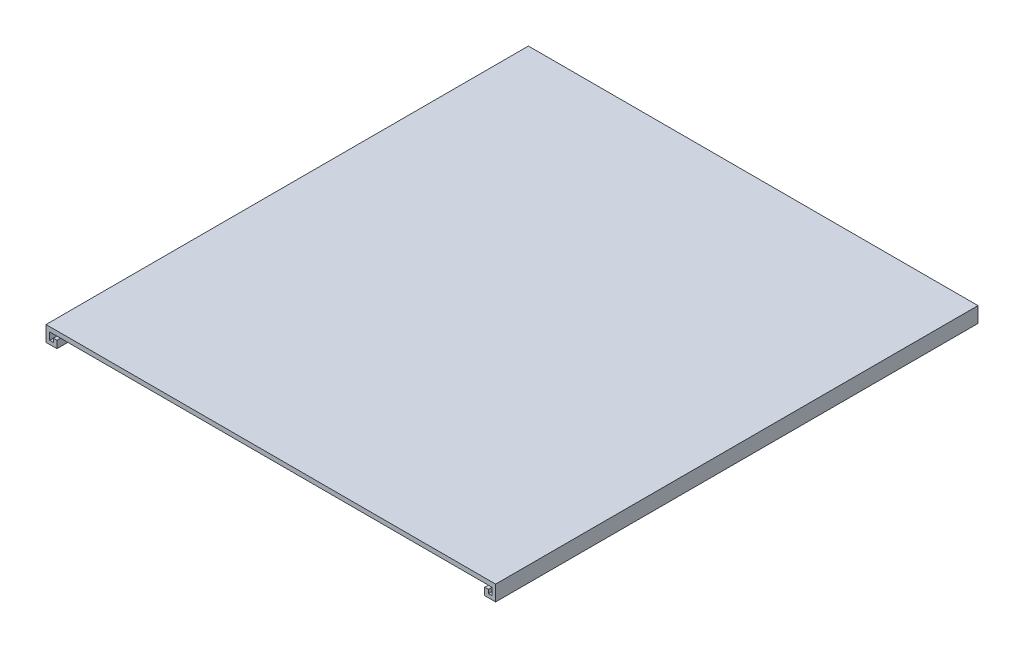
from build123d import *

# Parameters (mm, degrees)
SKETCH2_W                = 243
SKETCH2_H                = 265
BOSS_EXTRUDE1_DEPTH      = 2.5
BOSS_EXTRUDE2_DEPTH      = 4
BOSS_EXTRUDE2_DEPTH_BACK = 2.5
SKETCH3_W                = 2
SKETCH3_H                = 265
BOSS_EXTRUDE3_DEPTH      = 4
BOSS_EXTRUDE3_DEPTH_BACK = 2.5
SKETCH4_W                = 2
SKETCH4_H                = 265
BOSS_EXTRUDE4_DEPTH      = 2
BOSS_EXTRUDE4_DEPTH_BACK = 2
SKETCH5_W                = 265
SKETCH5_H                = 2
BOSS_EXTRUDE5_DEPTH      = 2
BOSS_EXTRUDE5_DEPTH_BACK = 2
SKETCH6_W                = 265
SKETCH6_H                = 2
SKETCH7_W                = 2
SKETCH7_H                = 265
BOSS_EXTRUDE7_DEPTH      = 4
SKETCH8_W                = 2
SKETCH8_H                = 265
BOSS_EXTRUDE8_DEPTH      = 4


with BuildPart() as part:
    # Sketch2 → Boss-Extrude1 (new body)
    with BuildSketch(Plane(origin=(0, 0, 0), x_dir=(1, 0, 0), z_dir=(0, 1, 0))):
        Rectangle(SKETCH2_W, SKETCH2_H)
    extrude(amount=BOSS_EXTRUDE1_DEPTH)

    # Sketch3 → Boss-Extrude2 (add, two sides: drawn at the far end of the back side and taken through both)
    with BuildSketch(Plane.XZ.offset(-BOSS_EXTRUDE2_DEPTH_BACK)):
        with Locations((122.5, 0)):
            Rectangle(SKETCH3_W, SKETCH3_H)
    extrude(amount=BOSS_EXTRUDE2_DEPTH + BOSS_EXTRUDE2_DEPTH_BACK)

    # Sketch4 → Boss-Extrude3 (add, two sides: drawn at the far end of the back side and taken through both)
    with BuildSketch(Plane.XZ.offset(-BOSS_EXTRUDE3_DEPTH_BACK)):
        with Locations((-122.5, 0)):
            Rectangle(SKETCH4_W, SKETCH4_H)
    extrude(amount=BOSS_EXTRUDE3_DEPTH + BOSS_EXTRUDE3_DEPTH_BACK)

    # Sketch5 → Boss-Extrude4 (add, two sides: drawn at the far end of the back side and taken through both)
    with BuildSketch(Plane(origin=(-121.5, 0, 0), x_dir=(0, 0, -1), z_dir=(1, 0, 0)).offset(-BOSS_EXTRUDE4_DEPTH_BACK)):
        with Locations((0, -5)):
            Rectangle(SKETCH5_W, SKETCH5_H)
    extrude(amount=BOSS_EXTRUDE4_DEPTH + BOSS_EXTRUDE4_DEPTH_BACK)

    # Sketch6 → Boss-Extrude5 (add, two sides: drawn at the far end of the back side and taken through both)
    with BuildSketch(Plane.ZY.offset(-121.5).offset(-BOSS_EXTRUDE5_DEPTH_BACK)):
        with Locations((0, -5)):
            Rectangle(SKETCH6_W, SKETCH6_H)
    extrude(amount=BOSS_EXTRUDE5_DEPTH + BOSS_EXTRUDE5_DEPTH_BACK)

    # Sketch7 → Boss-Extrude7 (add)
    with BuildSketch(Plane.XZ.offset(6)):
        with Locations((118.5, 0)):
            Rectangle(SKETCH7_W, SKETCH7_H)
    extrude(amount=-BOSS_EXTRUDE7_DEPTH)

    # Sketch8 → Boss-Extrude8 (add)
    with BuildSketch(Plane.XZ.offset(6)):
        with Locations((-118.5, 0)):
            Rectangle(SKETCH8_W, SKETCH8_H)
    extrude(amount=-BOSS_EXTRUDE8_DEPTH)


solid = part.part
